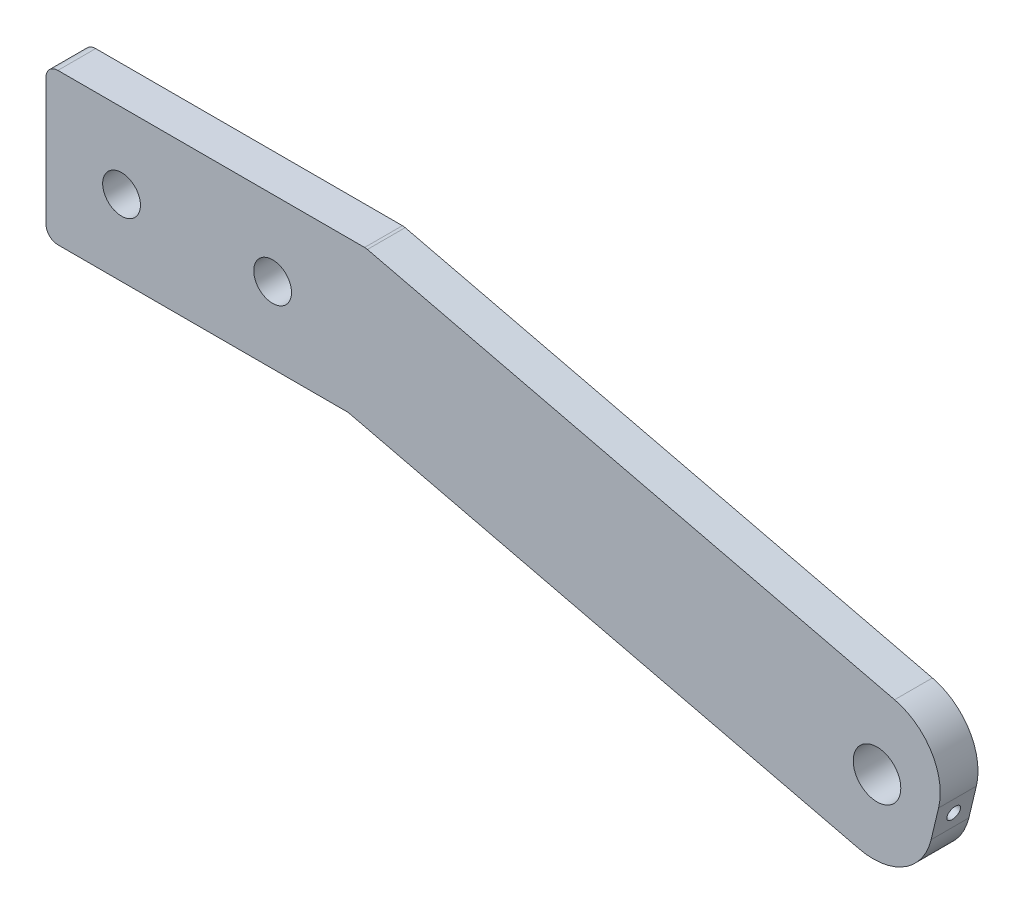
from build123d import *

# Parameters (mm, degrees)
SKETCH1_R               = 3.175
SKETCH1_R_2             = 4
BOSS_EXTRUDE1_DEPTH     = 6.35
CUT_EXTRUDE2_REACH      = 155.866
CUT_EXTRUDE2_END_RADIUS = 4
SKETCH3_R               = 1.1303
FILLET3_R               = 2
FILLET4_R               = 10


with BuildPart() as part:
    # Sketch1 → Boss-Extrude1 (new body)
    with BuildSketch(Plane.XY):
        Polygon((-38.1, -12.7), (-38.1, 12.7), (15.701735639, 12.7), (114.28491418, -10.930870684), (108.364133554, -35.631161305), (12.7, -12.7), align=None)
        with Locations((-25.4, 0)):
            Circle(SKETCH1_R, mode=Mode.SUBTRACT)
        Circle(SKETCH1_R, mode=Mode.SUBTRACT)
        with Locations((101.6, -20.95)):
            Circle(SKETCH1_R_2, mode=Mode.SUBTRACT)
    extrude(amount=BOSS_EXTRUDE1_DEPTH)

    # Cut-Extrude2: up to this cylinder (the profile starts outside it)
    cut_extrude2_end = Plane(origin=(101.6, -20.95, 3.175), z_dir=(0, 0, -1)) * Cylinder(CUT_EXTRUDE2_END_RADIUS, 320.732, mode=Mode.PRIVATE)
    # Sketch3 → Cut-Extrude2 (cut, up to the surface)
    with BuildSketch(Plane(origin=(110.552900462, -26.500071647, 0), x_dir=(0, 0, -1), z_dir=(0.9724523866696595, -0.23310159943784806, 0)), mode=Mode.PRIVATE) as cut_extrude2_sk1:
        with Locations(Location((-3.175, 3.310245002, 0), (0, 0, 90))):
            Circle(SKETCH3_R)
    cut_extrude2_tool1 = extrude(cut_extrude2_sk1.sketch, amount=-CUT_EXTRUDE2_REACH, mode=Mode.PRIVATE) - cut_extrude2_end
    add(cut_extrude2_tool1.solids().sort_by_distance((111.324524, -23.281016, 3.175))[0], mode=Mode.SUBTRACT)

    # Fillet3
    fillet3_edges = [part.edges().sort_by_distance(p)[0] for p in [
        (12.7, -12.7, 3.175),
        (-38.1, -12.7, 3.175),
        (-38.1, 12.7, 3.175),
        (15.701735639, 12.7, 3.175),
    ]]
    fillet(fillet3_edges, radius=FILLET3_R)

    # Fillet4
    fillet4_edges = [part.edges().sort_by_distance(p)[0] for p in [
        (108.364133554, -35.631161305, 3.175),
        (114.28491418, -10.930870684, 3.175),
    ]]
    fillet(fillet4_edges, radius=FILLET4_R)


solid = part.part
